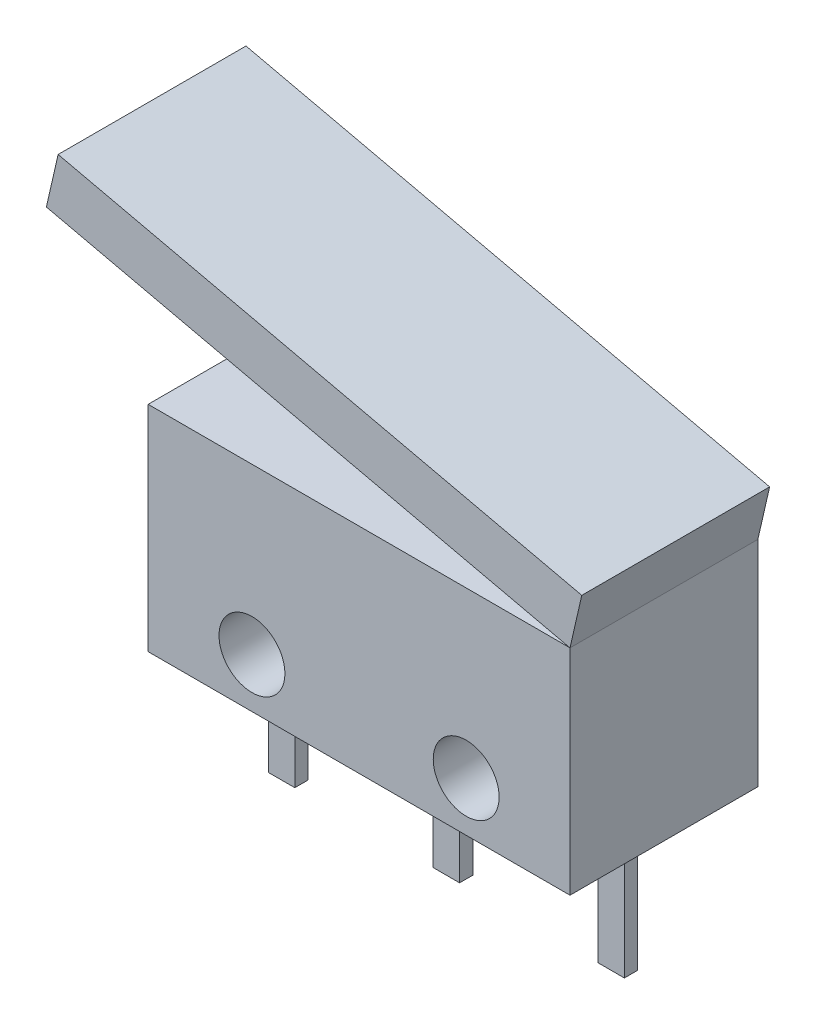
from build123d import *

# Parameters (mm, degrees)
ESQUISSE1_W             = 12.8
ESQUISSE1_H             = 6.5
BOSS_EXTRU_1_DEPTH      = 5.7
BOSS_EXTRU_1_2_DEPTH    = 5.7
ESQUISSE2_R             = 1
ENL_V_MAT_EXTRU_1_DEPTH = 5.7
ESQUISSE3_W             = 0.8
ESQUISSE3_H             = 0.4
BOSS_EXTRU_2_DEPTH      = 4


with BuildPart() as part:
    # Esquisse1 → Boss.-Extru.1 (new body)
    with BuildSketch(Plane.XY):
        with Locations((6.4, 3.25)):
            Rectangle(ESQUISSE1_W, ESQUISSE1_H)
    extrude(amount=BOSS_EXTRU_1_DEPTH)

    # Esquisse2 → Enlèv. mat.-Extru.1 (cut)
    with BuildSketch(Plane.XY.offset(5.7)):
        with Locations((3.15, 1.5)):
            Circle(ESQUISSE2_R)
        with Locations((9.65, 1.5)):
            Circle(ESQUISSE2_R)
    extrude(amount=-ENL_V_MAT_EXTRU_1_DEPTH, mode=Mode.SUBTRACT)

    # Esquisse3 → Boss.-Extru.2 (add)
    with BuildSketch(Plane.XZ):
        with Locations((6.4, 2.85)):
            Rectangle(ESQUISSE3_W, ESQUISSE3_H)
        with Locations((1.4, 2.85)):
            Rectangle(ESQUISSE3_W, ESQUISSE3_H)
        with Locations((11.4, 2.85)):
            Rectangle(ESQUISSE3_W, ESQUISSE3_H)
    extrude(amount=BOSS_EXTRU_2_DEPTH)


with BuildPart() as body_2:
    # Esquisse1 → Boss.-Extru.1 2 (new body)
    with BuildSketch(Plane.XY):
        Polygon((-3.08827816, 10.140414414), (12.8, 6.5), (13.157341292, 8.059585586), (-2.730936868, 11.7), align=None)
    extrude(amount=BOSS_EXTRU_1_2_DEPTH)


solid = Compound([part.part, body_2.part])
